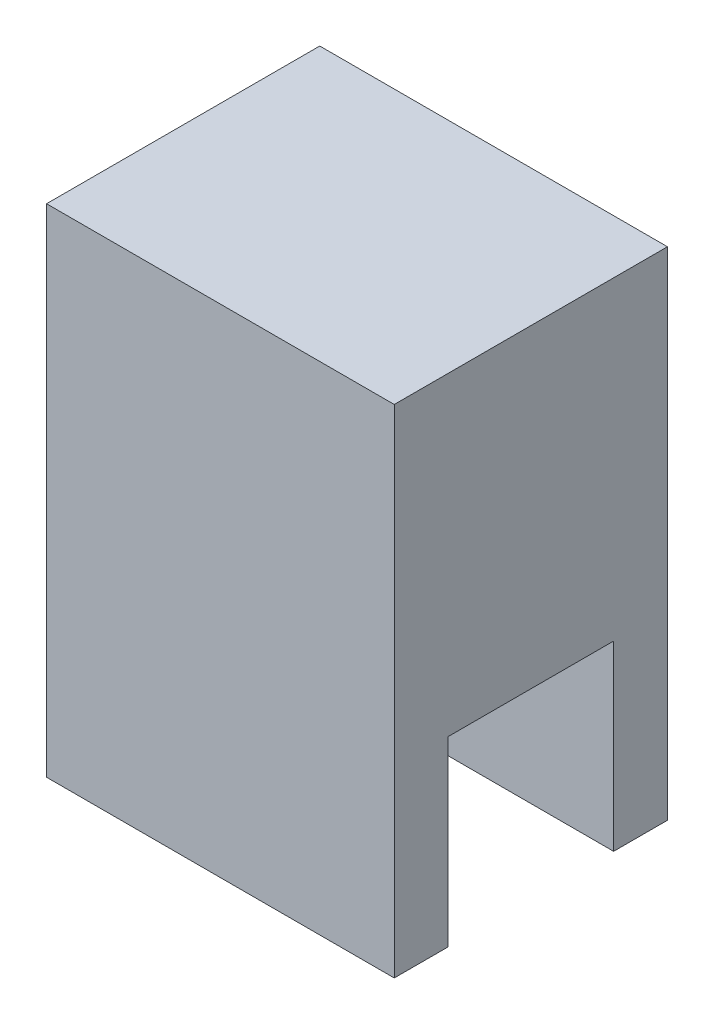
from build123d import *

# Parameters (mm, degrees)
SKETCH1_W               = 42
SKETCH1_H               = 33
BOSS_EXTRUDE1_DEPTH     = 30
CUT_EXTRUDE1_DEPTH      = 41.165283517
CUT_EXTRUDE1_DEPTH_BACK = 41.165283517
SKETCH2_W               = 20
SKETCH2_H               = 22


with BuildPart() as part:
    # Sketch1 → Boss-Extrude1 (new, symmetric)
    with BuildSketch(Plane(origin=(0, 0, 0), x_dir=(1, 0, 0), z_dir=(0, 1, 0))):
        Rectangle(SKETCH1_W, SKETCH1_H)
    extrude(amount=BOSS_EXTRUDE1_DEPTH, both=True)

    # Sketch2 → Cut-Extrude1 (cut, two sides: drawn at the far end of the back side and taken through both)
    with BuildSketch(Plane(origin=(0, 0, 0), x_dir=(0, 0, -1), z_dir=(1, 0, 0)).offset(-CUT_EXTRUDE1_DEPTH_BACK)):
        with Locations((0, -19)):
            Rectangle(SKETCH2_W, SKETCH2_H)
    extrude(amount=CUT_EXTRUDE1_DEPTH + CUT_EXTRUDE1_DEPTH_BACK, mode=Mode.SUBTRACT)


solid = part.part
